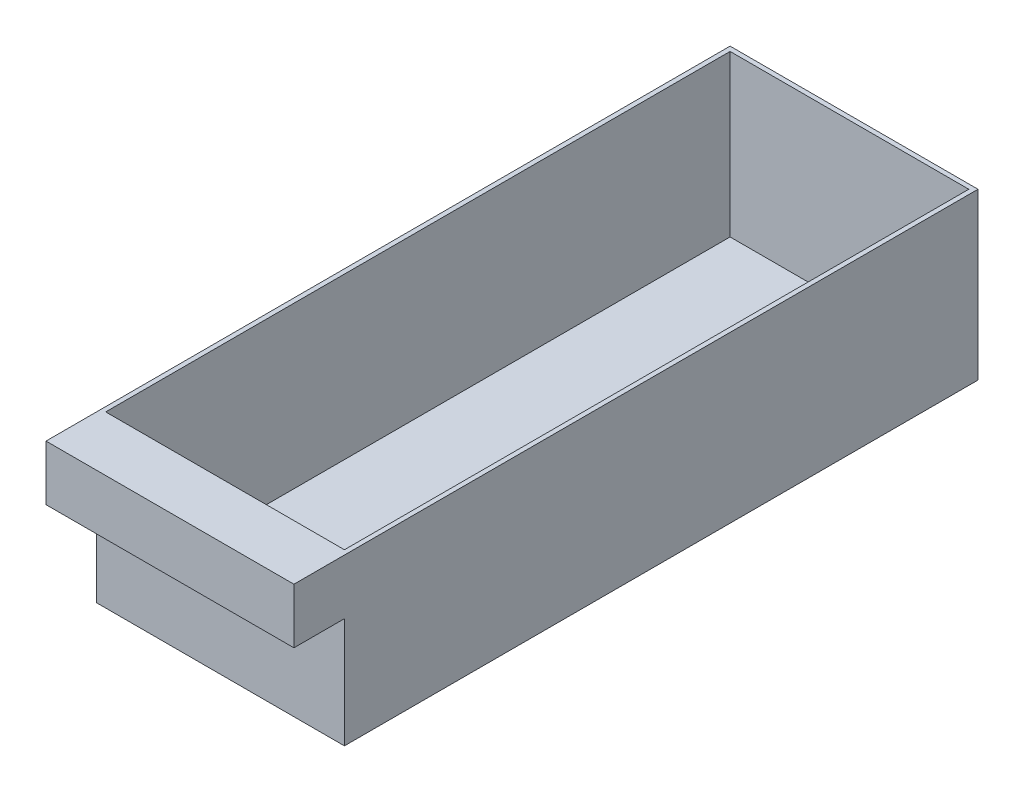
from build123d import *

# Parameters (mm, degrees)
SKETCH_4_W          = 54
SKETCH_4_H          = 138
EXTRUDE_1_DEPTH     = 36
SHELL_1_T           = -1
SKETCH_5_W          = 54
SKETCH_5_H          = 12
EXTRUDE_2_DEPTH     = 11
SKETCH_6_W          = 52
SKETCH_6_H          = 10
CUT_EXTRUDE_1_DEPTH = 11


with BuildPart() as part:
    # 草图4 → 凸台-拉伸1 (new body)
    with BuildSketch(Plane(origin=(0, 0, 0), x_dir=(1, 0, 0), z_dir=(0, 1, 0))):
        Rectangle(SKETCH_4_W, SKETCH_4_H)
    extrude(amount=EXTRUDE_1_DEPTH)

    # 抽壳1
    shell_1_openings = [part.faces().sort_by_distance(p)[0] for p in [
        (0, 36, 0),
    ]]
    offset(amount=SHELL_1_T, openings=shell_1_openings, kind=Kind.INTERSECTION)

    # 草图5 → 凸台-拉伸2 (add)
    with BuildSketch(Plane.XY.offset(69)):
        with Locations((0, 30)):
            Rectangle(SKETCH_5_W, SKETCH_5_H)
    extrude(amount=EXTRUDE_2_DEPTH)

    # 草图6 → 切除-拉伸1 (cut)
    with BuildSketch(Plane.XZ.offset(-24)):
        with Locations((0, 74)):
            Rectangle(SKETCH_6_W, SKETCH_6_H)
    extrude(amount=-CUT_EXTRUDE_1_DEPTH, mode=Mode.SUBTRACT)


solid = part.part
